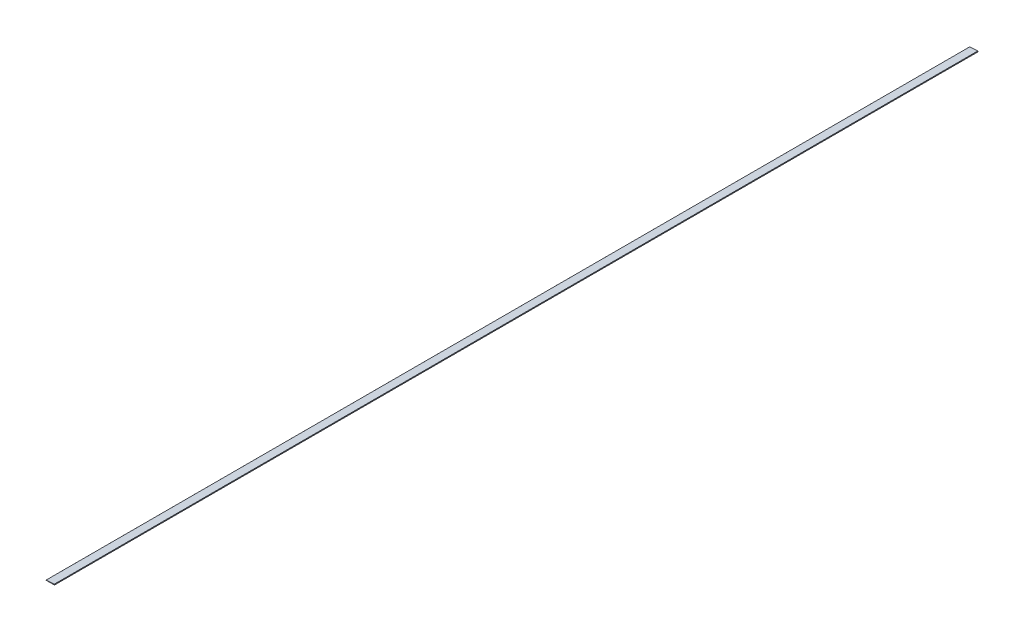
from build123d import *

# Parameters (mm, degrees)
BOSS_EXTRUDE1_DEPTH = 5000
FILLET1_R           = 0.2286


with BuildPart() as part:
    # Sketch1 → Boss-Extrude1 (new body)
    with BuildSketch(Plane.XY):
        Polygon((0, 0), (50.414116927, 4.410663713), (50.8, 0), align=None)
    extrude(amount=-BOSS_EXTRUDE1_DEPTH)

    # Fillet1
    fillet1_edges = [part.edges().sort_by_distance(p)[0] for p in [
        (0, 0, -2500),
    ]]
    fillet(fillet1_edges, radius=FILLET1_R)


solid = part.part
